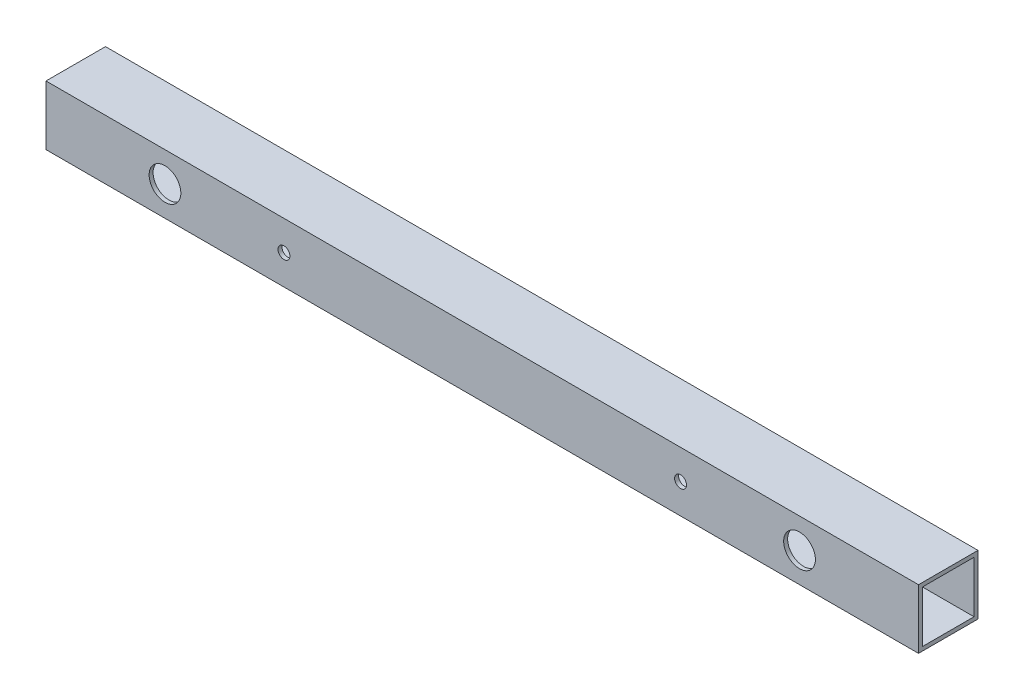
from build123d import *

# Parameters (mm, degrees)
SKETCH_1_W          = 15
SKETCH_1_H          = 15
SKETCH_1_W_2        = 13
SKETCH_1_H_2        = 13
EXTRUDE_1_DEPTH     = 220
SKETCH_2_R          = 1.5
CUT_EXTRUDE_4_DEPTH = 221.638278637
SKETCH_5_R          = 4
CUT_EXTRUDE_5_DEPTH = 10
SKETCH_6_R          = 4
CUT_EXTRUDE_6_DEPTH = 10


with BuildPart() as part:
    # 草图1 → 凸台-拉伸1 (new body)
    with BuildSketch(Plane(origin=(0, 0, 0), x_dir=(0, 0, -1), z_dir=(1, 0, 0))):
        Rectangle(SKETCH_1_W, SKETCH_1_H)
        Rectangle(SKETCH_1_W_2, SKETCH_1_H_2, mode=Mode.SUBTRACT)
    extrude(amount=EXTRUDE_1_DEPTH)

    # 草图2 → 切除-拉伸4 (cut, through all)
    with BuildSketch(Plane(origin=(0, 0, -7.5), x_dir=(-1, 0, 0), z_dir=(0, 0, -1))):
        with Locations((-30, 0)):
            Circle(SKETCH_2_R)
        with Locations((-60, 0)):
            Circle(SKETCH_2_R)
        with Locations(Location((-160, 0, 0), (0, 0, 270))):
            Circle(SKETCH_2_R)
        with Locations(Location((-190, 0, 0), (0, 0, 270))):
            Circle(SKETCH_2_R)
    extrude(amount=-CUT_EXTRUDE_4_DEPTH, mode=Mode.SUBTRACT)

    # 草图5 → 切除-拉伸5 (cut)
    with BuildSketch(Plane(origin=(0, 0, -7.5), x_dir=(-1, 0, 0), z_dir=(0, 0, -1))):
        with Locations((-160, 0)):
            Circle(SKETCH_5_R)
        with Locations((-60, 0)):
            Circle(SKETCH_5_R)
    extrude(amount=-CUT_EXTRUDE_5_DEPTH, mode=Mode.SUBTRACT)

    # 草图6 → 切除-拉伸6 (cut)
    with BuildSketch(Plane.XY.offset(7.5)):
        with Locations((190, 0)):
            Circle(SKETCH_6_R)
        with Locations((30, 0)):
            Circle(SKETCH_6_R)
    extrude(amount=-CUT_EXTRUDE_6_DEPTH, mode=Mode.SUBTRACT)


solid = part.part
